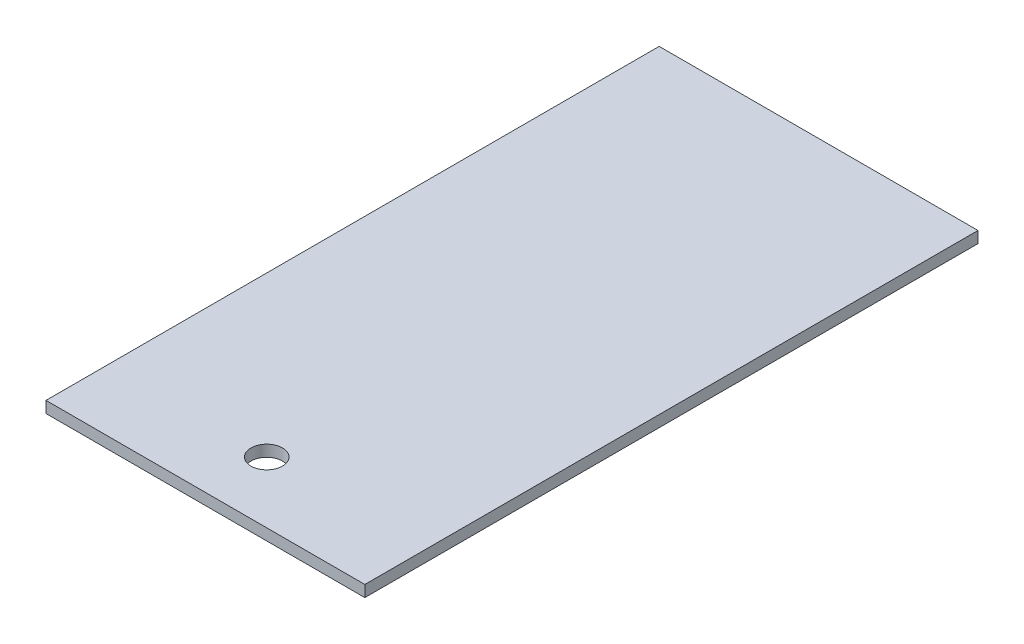
from build123d import *

# Parameters (mm, degrees)
SKETCH1_W           = 66.04
SKETCH1_H           = 127
BOSS_EXTRUDE1_DEPTH = 2.3622
SKETCH2_R           = 3.2639
CUT_EXTRUDE1_DEPTH  = 144.163757945


with BuildPart() as part:
    # Sketch1 → Boss-Extrude1 (new body)
    with BuildSketch(Plane(origin=(0, 0, 0), x_dir=(1, 0, 0), z_dir=(0, 1, 0))):
        with Locations((33.02, 63.5)):
            Rectangle(SKETCH1_W, SKETCH1_H)
    extrude(amount=BOSS_EXTRUDE1_DEPTH)

    # Sketch2 → Cut-Extrude1 (cut, through all)
    with BuildSketch(Plane(origin=(0, 2.3622, 0), x_dir=(1, 0, 0), z_dir=(0, 1, 0))):
        with Locations(Location((33.02, 12.7, 0), (0, 0, 270))):
            Circle(SKETCH2_R)
    extrude(amount=-CUT_EXTRUDE1_DEPTH, mode=Mode.SUBTRACT)


solid = part.part
